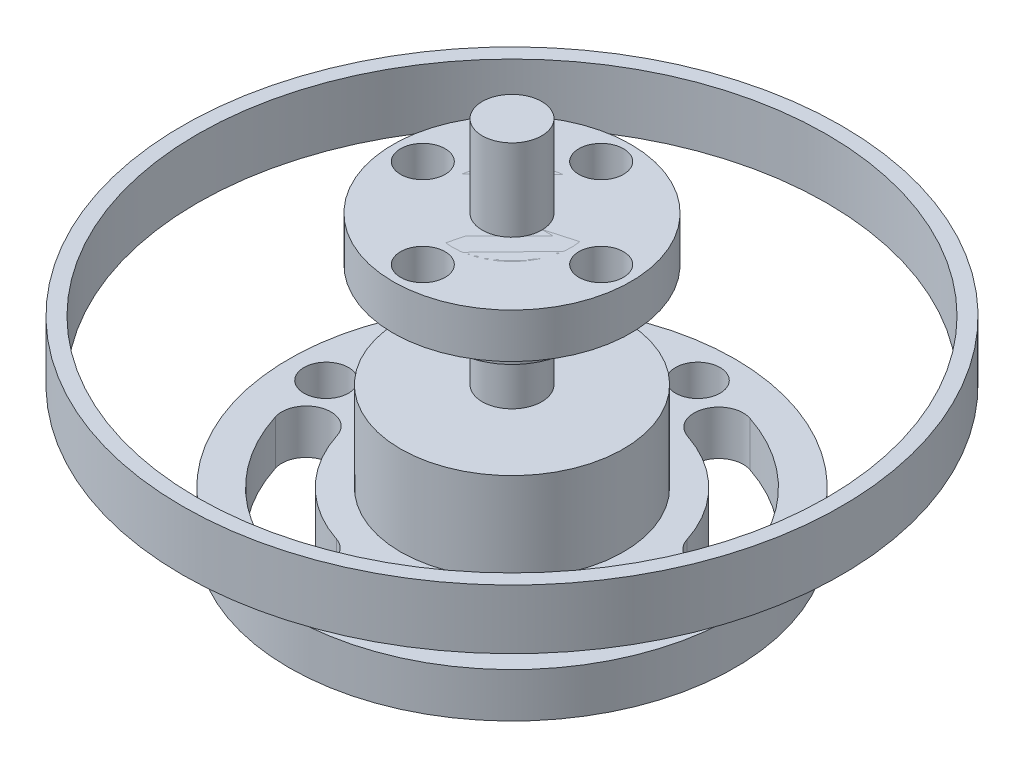
from build123d import *

# Parameters (mm, degrees)
BOSS_EXTRUDE3_DEPTH      = 24.5
BOSS_EXTRUDE3_DEPTH_BACK = 2.5
SKETCH1_R                = 2
SKETCH1_6_R              = 7.5
BOSS_EXTRUDE4_DEPTH      = 9
SKETCH1_8_R              = 15
SKETCH1_8_R_2            = 1.5
SKETCH1_8_R_3            = 7.5
BOSS_EXTRUDE5_DEPTH      = 3
SKETCH3_R                = 22.175
SKETCH3_R_2              = 21.175
BOSS_EXTRUDE6_DEPTH      = 4
SKETCH4_R                = 4
BOSS_EXTRUDE7_DEPTH      = 6
SKETCH5_R                = 8
SKETCH5_R_2              = 1.5
BOSS_EXTRUDE8_DEPTH      = 3


with BuildPart() as part:
    # Sketch1 → Boss-Extrude3 (new, two sides: drawn at the far end of the back side and taken through both)
    with BuildSketch(Plane(origin=(0, 0, 0), x_dir=(1, 0, 0), z_dir=(0, 1, 0)).offset(-BOSS_EXTRUDE3_DEPTH_BACK)):
        Circle(SKETCH1_R)
    extrude(amount=BOSS_EXTRUDE3_DEPTH + BOSS_EXTRUDE3_DEPTH_BACK)



with BuildPart() as body_2:
    # Sketch1<6> → Boss-Extrude4 (new body)
    with BuildSketch(Plane(origin=(0, 0, 0), x_dir=(1, 0, 0), z_dir=(0, 1, 0))):
        Circle(SKETCH1_6_R)
    extrude(amount=BOSS_EXTRUDE4_DEPTH)


with BuildPart() as part_1:
    add(part.part)

    add(body_2.part)  # Boss-Extrude5 merges body 2
    # Sketch1<8> → Boss-Extrude5 (add)
    with BuildSketch(Plane(origin=(0, 0, 0), x_dir=(1, 0, 0), z_dir=(0, 1, 0))):
        Circle(SKETCH1_8_R)
        with Locations((-12.5, 0)):
            Circle(SKETCH1_8_R_2, mode=Mode.SUBTRACT)
        with BuildLine():
            ThreePointArc((-3.948750659, -12.04910118), (-9.007445058, -8.924091244), (-12.085290806, -3.836563193))
            ThreePointArc((-12.085290806, -3.836563193), (-11.006987994, -1.755202195), (-8.925626996, -2.833505007))
            ThreePointArc((-8.925626996, -2.833505007), (-6.652474985, -6.590913781), (-2.916361389, -8.898899041))
            ThreePointArc((-2.916361389, -8.898899041), (-1.857454955, -10.990194746), (-3.948750659, -12.04910118))
        make_face(mode=Mode.SUBTRACT)
        with Locations((0, -12.5)):
            Circle(SKETCH1_8_R_2, mode=Mode.SUBTRACT)
        with BuildLine():
            ThreePointArc((12.04910118, -3.948750659), (8.924091244, -9.007445058), (3.836563193, -12.085290806))
            ThreePointArc((3.836563193, -12.085290806), (1.755202195, -11.006987994), (2.833505007, -8.925626996))
            ThreePointArc((2.833505007, -8.925626996), (6.590913781, -6.652474985), (8.898899041, -2.916361389))
            ThreePointArc((8.898899041, -2.916361389), (10.990194746, -1.857454955), (12.04910118, -3.948750659))
        make_face(mode=Mode.SUBTRACT)
        with BuildLine():
            ThreePointArc((-12.04910118, 3.948750659), (-8.924091244, 9.007445058), (-3.836563193, 12.085290806))
            ThreePointArc((-3.836563193, 12.085290806), (-1.755202195, 11.006987994), (-2.833505007, 8.925626996))
            ThreePointArc((-2.833505007, 8.925626996), (-6.590913781, 6.652474985), (-8.898899041, 2.916361389))
            ThreePointArc((-8.898899041, 2.916361389), (-10.990194746, 1.857454955), (-12.04910118, 3.948750659))
        make_face(mode=Mode.SUBTRACT)
        Circle(SKETCH1_8_R_3, mode=Mode.SUBTRACT)
        with BuildLine():
            ThreePointArc((3.948750659, 12.04910118), (9.007445058, 8.924091244), (12.085290806, 3.836563193))
            ThreePointArc((12.085290806, 3.836563193), (11.006987994, 1.755202195), (8.925626996, 2.833505007))
            ThreePointArc((8.925626996, 2.833505007), (6.652474985, 6.590913781), (2.916361389, 8.898899041))
            ThreePointArc((2.916361389, 8.898899041), (1.857454955, 10.990194746), (3.948750659, 12.04910118))
        make_face(mode=Mode.SUBTRACT)
        with Locations((12.5, 0)):
            Circle(SKETCH1_8_R_2, mode=Mode.SUBTRACT)
        with Locations((0, 12.5)):
            Circle(SKETCH1_8_R_2, mode=Mode.SUBTRACT)
    extrude(amount=BOSS_EXTRUDE5_DEPTH)

    # Sketch4 → Boss-Extrude7 (add)
    with BuildSketch(Plane(origin=(0, 13, 0), x_dir=(1, 0, 0), z_dir=(0, 1, 0))):
        Circle(SKETCH4_R)
    extrude(amount=BOSS_EXTRUDE7_DEPTH)


with BuildPart() as body_2_2:
    # Sketch3 → Boss-Extrude6 (new body)
    with BuildSketch(Plane(origin=(0, 9, 0), x_dir=(1, 0, 0), z_dir=(0, 1, 0))):
        Circle(SKETCH3_R)
        Circle(SKETCH3_R_2, mode=Mode.SUBTRACT)
    extrude(amount=BOSS_EXTRUDE6_DEPTH)


with BuildPart() as body_3:
    # Sketch5 → Boss-Extrude8 (new body)
    with BuildSketch(Plane(origin=(0, 19, 0), x_dir=(1, 0, 0), z_dir=(0, 1, 0))):
        Circle(SKETCH5_R)
        with Locations((-6, 0)):
            Circle(SKETCH5_R_2, mode=Mode.SUBTRACT)
        with Locations((0, 6)):
            Circle(SKETCH5_R_2, mode=Mode.SUBTRACT)
        with Locations((6, 0)):
            Circle(SKETCH5_R_2, mode=Mode.SUBTRACT)
        with Locations((0, -6)):
            Circle(SKETCH5_R_2, mode=Mode.SUBTRACT)
    extrude(amount=-BOSS_EXTRUDE8_DEPTH)


solid = Compound([part_1.part, body_2_2.part, body_3.part])
